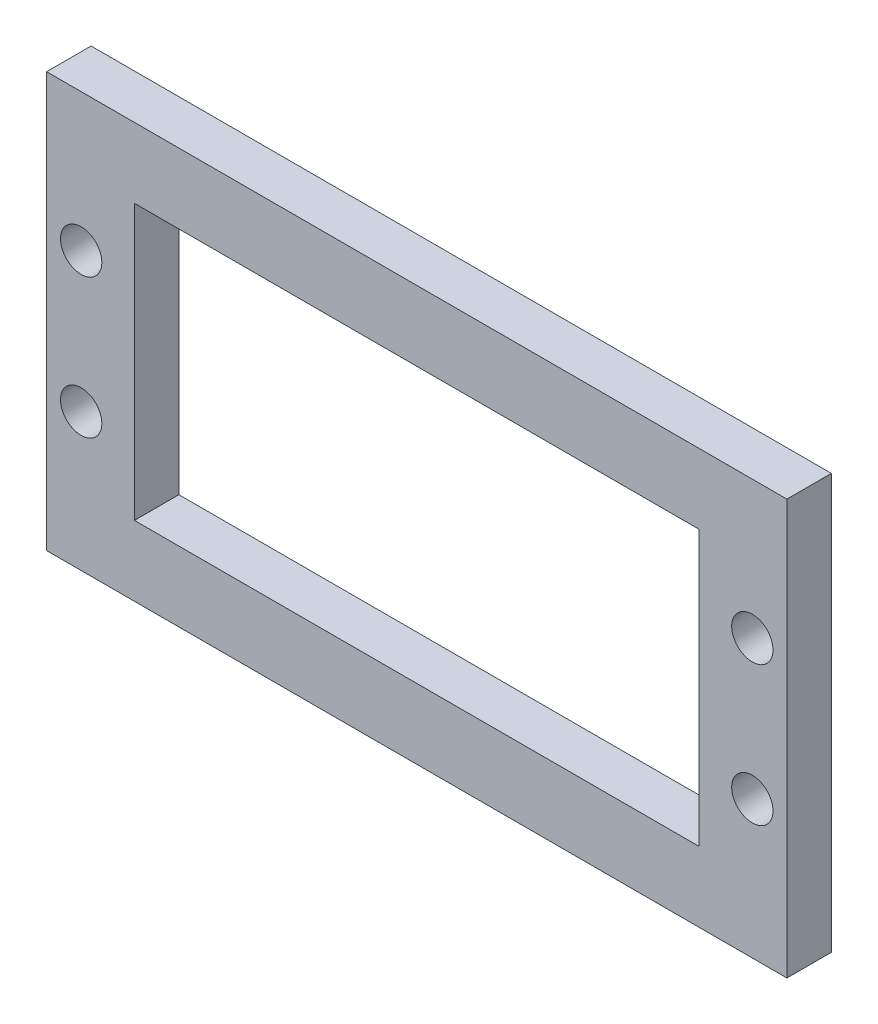
from build123d import *

# Parameters (mm, degrees)
SKETCH1_W           = 6.266
SKETCH1_H           = 19.6
SKETCH1_R           = 1.475
SKETCH1_W_2         = 52.832
SKETCH1_H_2         = 5
BOSS_EXTRUDE2_DEPTH = 3.175


with BuildPart() as part:
    # Sketch1 → Boss-Extrude2 (new body)
    # profile 1 of 4: a face of its own
    with BuildSketch(Plane.XY):
        with Locations((-23.283, 0)):
            Rectangle(SKETCH1_W, SKETCH1_H)
        with Locations((-23.95, -4.974)):
            Circle(SKETCH1_R, mode=Mode.SUBTRACT)
        with Locations((-23.95, 4.974)):
            Circle(SKETCH1_R, mode=Mode.SUBTRACT)
    # profile 2 of 4: a face of its own
    with BuildSketch(Plane.XY):
        with Locations((23.283, 0)):
            Rectangle(SKETCH1_W, SKETCH1_H)
        with Locations((23.95, -4.974)):
            Circle(SKETCH1_R, mode=Mode.SUBTRACT)
        with Locations((23.95, 4.974)):
            Circle(SKETCH1_R, mode=Mode.SUBTRACT)
    # profile 3 of 4: a face of its own
    with BuildSketch(Plane.XY):
        with Locations((0, 12.3)):
            Rectangle(SKETCH1_W_2, SKETCH1_H_2)
    # profile 4 of 4: a face of its own
    with BuildSketch(Plane.XY):
        with Locations((0, -12.3)):
            Rectangle(SKETCH1_W_2, SKETCH1_H_2)
    extrude(amount=BOSS_EXTRUDE2_DEPTH)


solid = part.part
